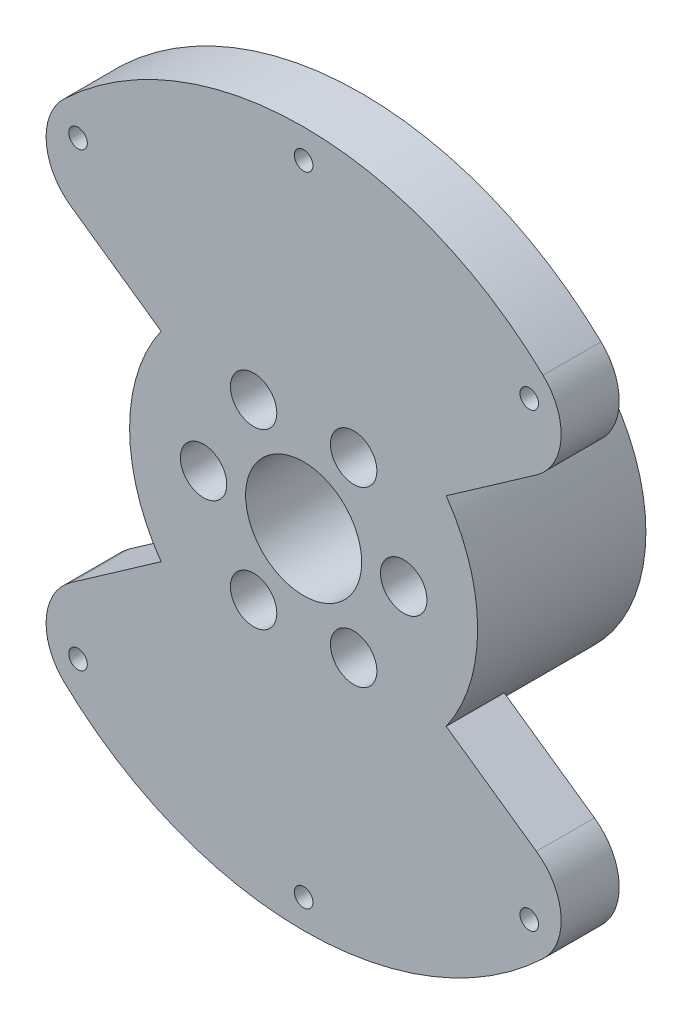
from build123d import *

# Parameters (mm, degrees)
SKETCH_1_R           = 30
EXTRUDE_1_DEPTH      = 24
SKETCH_6_R           = 10
CUT_EXTRUDE_5_DEPTH  = 26
SKETCH_7_R           = 2.2
CUT_EXTRUDE_6_DEPTH  = 49.744230428
SKETCH_8_R           = 4
SKETCH_8_R_2         = 2.2
CUT_EXTRUDE_7_DEPTH  = 19
EXTRUDE_START        = -10
SKETCH_9_R           = 60
SKETCH_9_R_2         = 30
EXTRUDE_2_DEPTH      = 10
CUT_EXTRUDE_8_DEPTH  = 3
SKETCH_11_R          = 1.6
CUT_EXTRUDE_9_DEPTH  = 87
CUT_EXTRUDE_START    = -10
CUT_EXTRUDE_11_DEPTH = 10
CUT_EXTRUDE_12_DEPTH = 10
FILLET_1_R           = 10
SKETCH_14_R          = 30
SKETCH_14_R_2        = 10
SKETCH_14_R_3        = 2.2
EXTRUDE_3_DEPTH      = 5


with BuildPart() as part:
    # 草图1 → 凸台-拉伸1 (new body)
    with BuildSketch(Plane.XY):
        Circle(SKETCH_1_R)
    extrude(amount=EXTRUDE_1_DEPTH)

    # 草图6 → 切除-拉伸5 (cut)
    with BuildSketch(Plane.XY.offset(24)):
        Circle(SKETCH_6_R)
    extrude(amount=-CUT_EXTRUDE_5_DEPTH, mode=Mode.SUBTRACT)

    # 草图7 → 切除-拉伸6 (cut, through all)
    with BuildSketch(Plane.XY.offset(24)):
        with Locations((17.25, 0)):
            Circle(SKETCH_7_R)
        with Locations((8.625, -14.938938215)):
            Circle(SKETCH_7_R)
        with Locations((-8.625, -14.938938215)):
            Circle(SKETCH_7_R)
        with Locations((-17.25, 0)):
            Circle(SKETCH_7_R)
        with Locations((-8.625, 14.938938215)):
            Circle(SKETCH_7_R)
        with Locations((8.625, 14.938938215)):
            Circle(SKETCH_7_R)
    extrude(amount=-CUT_EXTRUDE_6_DEPTH, mode=Mode.SUBTRACT)

    # 草图8 → 切除-拉伸7 (cut)
    # profile 1 of 6: a face of its own
    with BuildSketch(Plane.XY.offset(24)):
        with Locations((-8.625, 14.938938215)):
            Circle(SKETCH_8_R)
        with Locations((-8.625, 14.938938215)):
            Circle(SKETCH_8_R_2, mode=Mode.SUBTRACT)
    # profile 2 of 6: a face of its own
    with BuildSketch(Plane.XY.offset(24)):
        with Locations((-17.25, 0)):
            Circle(SKETCH_8_R)
        with Locations((-17.25, 0)):
            Circle(SKETCH_8_R_2, mode=Mode.SUBTRACT)
    # profile 3 of 6: a face of its own
    with BuildSketch(Plane.XY.offset(24)):
        with Locations((8.625, 14.938938215)):
            Circle(SKETCH_8_R)
        with Locations((8.625, 14.938938215)):
            Circle(SKETCH_8_R_2, mode=Mode.SUBTRACT)
    # profile 4 of 6: a face of its own
    with BuildSketch(Plane.XY.offset(24)):
        with Locations((17.25, 0)):
            Circle(SKETCH_8_R)
        with Locations((17.25, 0)):
            Circle(SKETCH_8_R_2, mode=Mode.SUBTRACT)
    # profile 5 of 6: a face of its own
    with BuildSketch(Plane.XY.offset(24)):
        with Locations((8.625, -14.938938215)):
            Circle(SKETCH_8_R)
        with Locations((8.625, -14.938938215)):
            Circle(SKETCH_8_R_2, mode=Mode.SUBTRACT)
    # profile 6 of 6: a face of its own
    with BuildSketch(Plane.XY.offset(24)):
        with Locations((-8.625, -14.938938215)):
            Circle(SKETCH_8_R)
        with Locations((-8.625, -14.938938215)):
            Circle(SKETCH_8_R_2, mode=Mode.SUBTRACT)
    extrude(amount=-CUT_EXTRUDE_7_DEPTH, mode=Mode.SUBTRACT)

    # 草图9 → 凸台-拉伸2 (add)
    with BuildSketch(Plane.XY.offset(24).offset(EXTRUDE_START)):
        Circle(SKETCH_9_R)
        Circle(SKETCH_9_R_2, mode=Mode.SUBTRACT)
    extrude(amount=EXTRUDE_2_DEPTH)

    # 草图10 → 切除-拉伸8 (cut)
    with BuildSketch(Plane(origin=(0, 0, 14), x_dir=(-1, 0, 0), z_dir=(0, 0, -1))):
        with BuildLine():
            ThreePointArc((-41.074439403, 36.577184524), (-38.890872965, 38.890872965), (-36.577184524, 41.074439403))
            Line((-36.577184524, 41.074439403), (-36.604682539, 41.177063392))
            Line((-36.604682539, 41.177063392), (-39.727676739, 42.013867166))
            Line((-39.727676739, 42.013867166), (-42.013867166, 39.727676739))
            Line((-42.013867166, 39.727676739), (-41.177063392, 36.604682539))
            Line((-41.177063392, 36.604682539), (-41.074439403, 36.577184524))
        make_face()
        with BuildLine():
            Line((-35.767878765, 38.054069191), (-36.577184524, 41.074439403))
            ThreePointArc((-36.577184524, 41.074439403), (-38.890872965, 38.890872965), (-41.074439403, 36.577184524))
            Line((-41.074439403, 36.577184524), (-38.054069191, 35.767878765))
            Line((-38.054069191, 35.767878765), (-35.767878765, 38.054069191))
        make_face()
        with BuildLine():
            ThreePointArc((-54.907989849, -3.180039422), (-55, 0), (-54.907989849, 3.180039422))
            Line((-54.907989849, 3.180039422), (-55, 3.233161507))
            Line((-55, 3.233161507), (-57.8, 1.616580754))
            Line((-57.8, 1.616580754), (-57.8, -1.616580754))
            Line((-57.8, -1.616580754), (-55, -3.233161507))
            Line((-55, -3.233161507), (-54.907989849, -3.180039422))
        make_face()
        with BuildLine():
            Line((-52.2, 1.616580754), (-54.907989849, 3.180039422))
            ThreePointArc((-54.907989849, 3.180039422), (-55, 0), (-54.907989849, -3.180039422))
            Line((-54.907989849, -3.180039422), (-52.2, -1.616580754))
            Line((-52.2, -1.616580754), (-52.2, 1.616580754))
        make_face()
        with BuildLine():
            ThreePointArc((-36.577184524, -41.074439403), (-38.890872965, -38.890872965), (-41.074439403, -36.577184524))
            Line((-41.074439403, -36.577184524), (-41.177063392, -36.604682539))
            Line((-41.177063392, -36.604682539), (-42.013867166, -39.727676739))
            Line((-42.013867166, -39.727676739), (-39.727676739, -42.013867166))
            Line((-39.727676739, -42.013867166), (-36.604682539, -41.177063392))
            Line((-36.604682539, -41.177063392), (-36.577184524, -41.074439403))
        make_face()
        with BuildLine():
            Line((-38.054069191, -35.767878765), (-41.074439403, -36.577184524))
            ThreePointArc((-41.074439403, -36.577184524), (-38.890872965, -38.890872965), (-36.577184524, -41.074439403))
            Line((-36.577184524, -41.074439403), (-35.767878765, -38.054069191))
            Line((-35.767878765, -38.054069191), (-38.054069191, -35.767878765))
        make_face()
        with BuildLine():
            Line((3.233161507, -55), (3.180039422, -54.907989849))
            ThreePointArc((3.180039422, -54.907989849), (0, -55), (-3.180039422, -54.907989849))
            Line((-3.180039422, -54.907989849), (-3.233161507, -55))
            Line((-3.233161507, -55), (-1.616580754, -57.8))
            Line((-1.616580754, -57.8), (1.616580754, -57.8))
            Line((1.616580754, -57.8), (3.233161507, -55))
        make_face()
        with BuildLine():
            ThreePointArc((-3.180039422, -54.907989849), (0, -55), (3.180039422, -54.907989849))
            Line((3.180039422, -54.907989849), (1.616580754, -52.2))
            Line((1.616580754, -52.2), (-1.616580754, -52.2))
            Line((-1.616580754, -52.2), (-3.180039422, -54.907989849))
        make_face()
        with BuildLine():
            Line((41.177063392, -36.604682539), (41.074439403, -36.577184524))
            ThreePointArc((41.074439403, -36.577184524), (38.890872965, -38.890872965), (36.577184524, -41.074439403))
            Line((36.577184524, -41.074439403), (36.604682539, -41.177063392))
            Line((36.604682539, -41.177063392), (39.727676739, -42.013867166))
            Line((39.727676739, -42.013867166), (42.013867166, -39.727676739))
            Line((42.013867166, -39.727676739), (41.177063392, -36.604682539))
        make_face()
        with BuildLine():
            ThreePointArc((36.577184524, -41.074439403), (38.890872965, -38.890872965), (41.074439403, -36.577184524))
            Line((41.074439403, -36.577184524), (38.054069191, -35.767878765))
            Line((38.054069191, -35.767878765), (35.767878765, -38.054069191))
            Line((35.767878765, -38.054069191), (36.577184524, -41.074439403))
        make_face()
        with BuildLine():
            Line((42.013867166, 39.727676739), (39.727676739, 42.013867166))
            Line((39.727676739, 42.013867166), (36.604682539, 41.177063392))
            Line((36.604682539, 41.177063392), (36.577184524, 41.074439403))
            ThreePointArc((36.577184524, 41.074439403), (38.890872965, 38.890872965), (41.074439403, 36.577184524))
            Line((41.074439403, 36.577184524), (41.177063392, 36.604682539))
            Line((41.177063392, 36.604682539), (42.013867166, 39.727676739))
        make_face()
        with BuildLine():
            ThreePointArc((41.074439403, 36.577184524), (38.890872965, 38.890872965), (36.577184524, 41.074439403))
            Line((36.577184524, 41.074439403), (35.767878765, 38.054069191))
            Line((35.767878765, 38.054069191), (38.054069191, 35.767878765))
            Line((38.054069191, 35.767878765), (41.074439403, 36.577184524))
        make_face()
        with BuildLine():
            Line((55, 3.233161507), (54.907989849, 3.180039422))
            ThreePointArc((54.907989849, 3.180039422), (54.97699265, 1.590685119), (55, 0))
            ThreePointArc((55, 0), (54.97699265, -1.590685119), (54.907989849, -3.180039422))
            Line((54.907989849, -3.180039422), (55, -3.233161507))
            Line((55, -3.233161507), (57.8, -1.616580754))
            Line((57.8, -1.616580754), (57.8, 1.616580754))
            Line((57.8, 1.616580754), (55, 3.233161507))
        make_face()
        with BuildLine():
            ThreePointArc((55, 0), (54.97699265, 1.590685119), (54.907989849, 3.180039422))
            Line((54.907989849, 3.180039422), (52.2, 1.616580754))
            Line((52.2, 1.616580754), (52.2, -1.616580754))
            Line((52.2, -1.616580754), (54.907989849, -3.180039422))
            ThreePointArc((54.907989849, -3.180039422), (54.97699265, -1.590685119), (55, 0))
        make_face()
        with BuildLine():
            ThreePointArc((-3.180039422, 54.907989849), (0, 55), (3.180039422, 54.907989849))
            Line((3.180039422, 54.907989849), (3.233161507, 55))
            Line((3.233161507, 55), (1.616580754, 57.8))
            Line((1.616580754, 57.8), (-1.616580754, 57.8))
            Line((-1.616580754, 57.8), (-3.233161507, 55))
            Line((-3.233161507, 55), (-3.180039422, 54.907989849))
        make_face()
        with BuildLine():
            Line((1.616580754, 52.2), (3.180039422, 54.907989849))
            ThreePointArc((3.180039422, 54.907989849), (0, 55), (-3.180039422, 54.907989849))
            Line((-3.180039422, 54.907989849), (-1.616580754, 52.2))
            Line((-1.616580754, 52.2), (1.616580754, 52.2))
        make_face()
    extrude(amount=-CUT_EXTRUDE_8_DEPTH, mode=Mode.SUBTRACT)

    # 草图11 → 切除-拉伸9 (cut, through all)
    with BuildSketch(Plane(origin=(0, 0, 14), x_dir=(-1, 0, 0), z_dir=(0, 0, -1))):
        with Locations((0, 55)):
            Circle(SKETCH_11_R)
        with Locations((-38.890872965, 38.890872965)):
            Circle(SKETCH_11_R)
        with Locations((-55, 0)):
            Circle(SKETCH_11_R)
        with Locations((-38.890872965, -38.890872965)):
            Circle(SKETCH_11_R)
        with Locations((0, -55)):
            Circle(SKETCH_11_R)
        with Locations((38.890872965, -38.890872965)):
            Circle(SKETCH_11_R)
        with Locations((55, 0)):
            Circle(SKETCH_11_R)
        with Locations((38.890872965, 38.890872965)):
            Circle(SKETCH_11_R)
    extrude(amount=-CUT_EXTRUDE_9_DEPTH, mode=Mode.SUBTRACT)

    # 草图12 → 切除-拉伸11 (cut)
    with BuildSketch(Plane.XY.offset(24).offset(CUT_EXTRUDE_START)):
        with BuildLine():
            Line((-54.199999992, 1.385640641), (-59.821019831, 4.630937959))
            ThreePointArc((-59.821019831, 4.630937959), (-60, 0), (-59.821019831, -4.630937959))
            Line((-59.821019831, -4.630937959), (-54.200000012, -1.385640653))
            ThreePointArc((-54.200000012, -1.385640653), (-56.6, 1.2e-08), (-54.199999992, 1.385640641))
        make_face()
        with BuildLine():
            Line((59.821019831, 4.630937959), (54.200000043, 1.385640671))
            ThreePointArc((54.200000043, 1.385640671), (56.6, -3e-09), (54.200000038, -1.385640668))
            Line((54.200000038, -1.385640668), (59.821019831, -4.630937959))
            ThreePointArc((59.821019831, -4.630937959), (60, 0), (59.821019831, 4.630937959))
        make_face()
    extrude(amount=CUT_EXTRUDE_11_DEPTH, mode=Mode.SUBTRACT)

    # 草图13 → 切除-拉伸12 (cut)
    with BuildSketch(Plane.XY.offset(24).offset(CUT_EXTRUDE_START)):
        with BuildLine():
            ThreePointArc((-30, 0), (-28.611508522, 9.021173985), (-24.574561329, 17.207293091))
            Line((-24.574561329, 17.207293091), (-49.149122657, 34.414586181))
            ThreePointArc((-49.149122657, 34.414586181), (-56.483532236, 20.238838558), (-59.821019831, 4.630937959))
            Line((-59.821019831, 4.630937959), (-54.2, 1.385640646))
            ThreePointArc((-54.2, 1.385640646), (-53.614359354, 0.8), (-53.4, 0))
            Line((-53.4, 0), (-30, 0))
        make_face()
        with BuildLine():
            ThreePointArc((-24.574561329, -17.207293091), (-28.611508522, -9.021173985), (-30, 0))
            Line((-30, 0), (-53.4, 0))
            ThreePointArc((-53.4, 0), (-53.614359354, -0.8), (-54.2, -1.385640646))
            Line((-54.2, -1.385640646), (-59.821019831, -4.630937959))
            ThreePointArc((-59.821019831, -4.630937959), (-56.483532236, -20.238838558), (-49.149122657, -34.414586181))
            Line((-49.149122657, -34.414586181), (-24.574561329, -17.207293091))
        make_face()
        with BuildLine():
            ThreePointArc((24.574561329, 17.207293091), (28.611508522, 9.021173985), (30, 0))
            Line((30, 0), (53.4, 0))
            ThreePointArc((53.4, 0), (53.614359354, 0.8), (54.2, 1.385640646))
            Line((54.2, 1.385640646), (59.821019831, 4.630937959))
            ThreePointArc((59.821019831, 4.630937959), (56.483532236, 20.238838558), (49.149122657, 34.414586181))
            Line((49.149122657, 34.414586181), (24.574561329, 17.207293091))
        make_face()
        with BuildLine():
            Line((53.4, 0), (30, 0))
            ThreePointArc((30, 0), (28.611508522, -9.021173985), (24.574561329, -17.207293091))
            Line((24.574561329, -17.207293091), (49.149122657, -34.414586181))
            ThreePointArc((49.149122657, -34.414586181), (56.483532236, -20.238838558), (59.821019831, -4.630937959))
            Line((59.821019831, -4.630937959), (54.2, -1.385640646))
            ThreePointArc((54.2, -1.385640646), (53.614359354, -0.8), (53.4, 0))
        make_face()
    extrude(amount=CUT_EXTRUDE_12_DEPTH, mode=Mode.SUBTRACT)

    # 圆角1
    fillet_1_edges = [part.edges().sort_by_distance(p)[0] for p in [
        (-49.149122657, -34.414586181, 19),
        (-49.149122657, 34.414586181, 19),
        (49.149122657, 34.414586181, 19),
        (49.149122657, -34.414586181, 19),
    ]]
    fillet(fillet_1_edges, radius=FILLET_1_R)

    # 草图14 → 凸台-拉伸3 (add)
    with BuildSketch(Plane(origin=(0, 0, 0), x_dir=(-1, 0, 0), z_dir=(0, 0, -1))):
        Circle(SKETCH_14_R)
        with Locations(Location((0, 0, 0), (0, 0, 180))):
            Circle(SKETCH_14_R_2, mode=Mode.SUBTRACT)
        with Locations(Location((8.625, 14.938938215, 0), (0, 0, 180))):
            Circle(SKETCH_14_R_3, mode=Mode.SUBTRACT)
        with Locations(Location((17.25, 0, 0), (0, 0, 180))):
            Circle(SKETCH_14_R_3, mode=Mode.SUBTRACT)
        with Locations(Location((8.625, -14.938938215, 0), (0, 0, 180))):
            Circle(SKETCH_14_R_3, mode=Mode.SUBTRACT)
        with Locations(Location((-8.625, -14.938938215, 0), (0, 0, 180))):
            Circle(SKETCH_14_R_3, mode=Mode.SUBTRACT)
        with Locations(Location((-8.625, 14.938938215, 0), (0, 0, 180))):
            Circle(SKETCH_14_R_3, mode=Mode.SUBTRACT)
        with Locations(Location((-17.25, 0, 0), (0, 0, 180))):
            Circle(SKETCH_14_R_3, mode=Mode.SUBTRACT)
    extrude(amount=EXTRUDE_3_DEPTH)


solid = part.part
